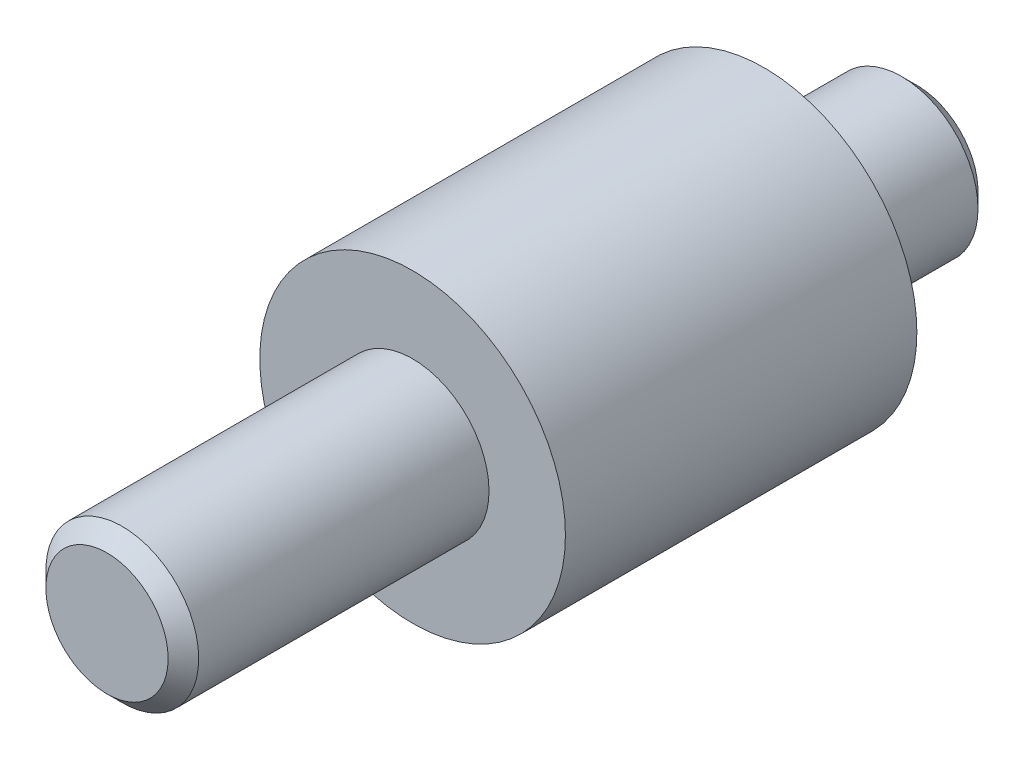
from build123d import *

# Parameters (mm, degrees)
SKETCH2_R           = 10
BOSS_EXTRUDE1_DEPTH = 23
SKETCH3_R           = 5
BOSS_EXTRUDE2_DEPTH = 20
BOSS_EXTRUDE3_START = 10
SKETCH4_R           = 5
BOSS_EXTRUDE3_DEPTH = 10
CHAMFER1_SIZE       = 1
CHAMFER2_SIZE       = 1


with BuildPart() as part:
    # Sketch2 → Boss-Extrude1 (new body)
    with BuildSketch(Plane.XY):
        Circle(SKETCH2_R)
    extrude(amount=BOSS_EXTRUDE1_DEPTH)

    # Sketch3 → Boss-Extrude2 (add)
    with BuildSketch(Plane.XY.offset(23)):
        Circle(SKETCH3_R)
    extrude(amount=BOSS_EXTRUDE2_DEPTH)

    # Sketch4 → Boss-Extrude3 (add)
    with BuildSketch(Plane(origin=(0, 0, 0), x_dir=(-1, 0, 0), z_dir=(0, 0, -1)).offset(BOSS_EXTRUDE3_START)):
        with Locations(Location((0, 0, 0), (0, 0, 180))):
            Circle(SKETCH4_R)
    extrude(amount=-BOSS_EXTRUDE3_DEPTH)

    # Chamfer1
    chamfer1_edges = [part.edges().sort_by_distance(p)[0] for p in [
        (-5, 0, -10),
    ]]
    chamfer(chamfer1_edges, length=CHAMFER1_SIZE)

    # Chamfer2
    chamfer2_edges = [part.edges().sort_by_distance(p)[0] for p in [
        (-5, 0, 43),
    ]]
    chamfer(chamfer2_edges, length=CHAMFER2_SIZE)


solid = part.part
